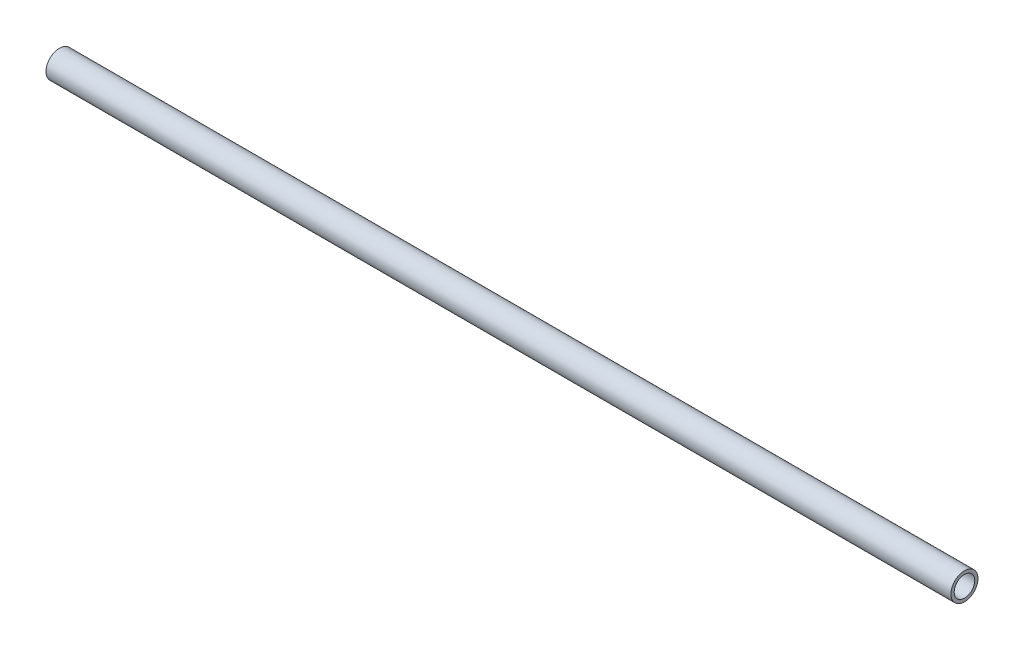
from build123d import *

# Parameters (mm, degrees)
SKETCH1_R           = 12.7
SKETCH1_R_2         = 9.652
BOSS_EXTRUDE1_DEPTH = 850


with BuildPart() as part:
    # Sketch1 → Boss-Extrude1 (new body)
    with BuildSketch(Plane(origin=(0, 0, 0), x_dir=(0, 0, -1), z_dir=(1, 0, 0))):
        Circle(SKETCH1_R)
        Circle(SKETCH1_R_2, mode=Mode.SUBTRACT)
    extrude(amount=BOSS_EXTRUDE1_DEPTH)


solid = part.part
